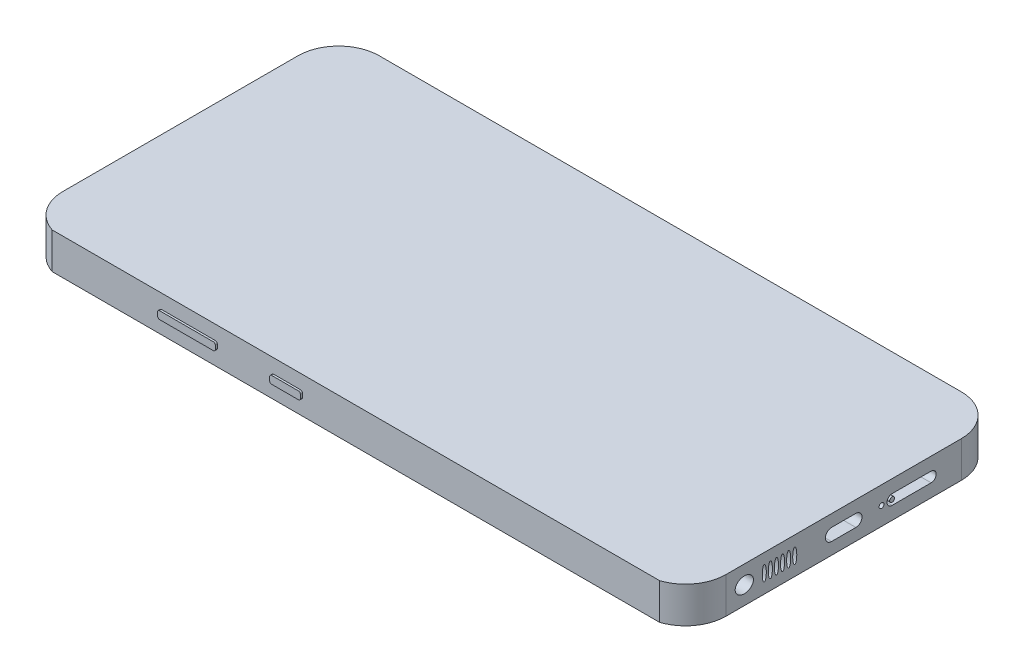
from build123d import *

# Parameters (mm, degrees)
EXTRUDE_1_DEPTH     = 8.9
CUT_EXTRUDE_START   = 163.3
SKETCH_2_R          = 0.6
SKETCH_2_RX         = 2.25
SKETCH_2_RY         = 1.9
SKETCH_2_RX_2       = 1.9
SKETCH_2_RY_2       = 0.5
CUT_EXTRUDE_5_DEPTH = 8.9
SKETCH_7_OUTSIDE_W  = 201.53
SKETCH_7_OUTSIDE_H  = 47.13
CUT_EXTRUDE_6_DEPTH = 0.5
CUT_EXTRUDE_7_DEPTH = 0.5


with BuildPart() as part:
    # 草图1 → 凸台-拉伸1 (new body)
    with BuildSketch(Plane(origin=(0, 0, 0), x_dir=(1, 0, 0), z_dir=(0, 1, 0))):
        with BuildLine():
            Line((10, 0), (153.3, 0))
            ThreePointArc((153.3, 0), (160.371067812, 2.928932188), (163.3, 10))
            Line((163.3, 10), (163.3, 67.9))
            ThreePointArc((163.3, 67.9), (160.371067812, 74.971067812), (153.3, 77.9))
            Line((153.3, 77.9), (10, 77.9))
            ThreePointArc((10, 77.9), (2.928932188, 74.971067812), (0, 67.9))
            Line((0, 67.9), (0, 10))
            ThreePointArc((0, 10), (2.928932188, 2.928932188), (10, 0))
        make_face()
    extrude(amount=EXTRUDE_1_DEPTH)

    # 草图2 → 切除-拉伸5 (cut)
    # profile 1 of 10: a face of its own
    with BuildSketch(Plane(origin=(0, 0, 0), x_dir=(0, 0, -1), z_dir=(1, 0, 0)).offset(CUT_EXTRUDE_START)):
        with Locations(Location((48.272527564, 4.45, 0), (0, 0, 180))):
            Circle(SKETCH_2_R)
    # profile 2 of 10: a face of its own
    with BuildSketch(Plane(origin=(0, 0, 0), x_dir=(0, 0, -1), z_dir=(1, 0, 0)).offset(CUT_EXTRUDE_START)):
        with Locations(Location((14.485427664, 4.45), (0, 0, 180))):
            Ellipse(SKETCH_2_RX, SKETCH_2_RY)
    # profile 3 of 10: a face of its own
    with BuildSketch(Plane(origin=(0, 0, 0), x_dir=(0, 0, -1), z_dir=(1, 0, 0)).offset(CUT_EXTRUDE_START)):
        with Locations(Location((19.399284115, 4.45), (0, 0, 90))):
            Ellipse(SKETCH_2_RX_2, SKETCH_2_RY_2)
    # profile 4 of 10: a face of its own
    with BuildSketch(Plane(origin=(0, 0, 0), x_dir=(0, 0, -1), z_dir=(1, 0, 0)).offset(CUT_EXTRUDE_START)):
        with Locations(Location((20.899284115, 4.45), (0, 0, 90))):
            Ellipse(SKETCH_2_RX_2, SKETCH_2_RY_2)
    # profile 5 of 10: a face of its own
    with BuildSketch(Plane(origin=(0, 0, 0), x_dir=(0, 0, -1), z_dir=(1, 0, 0)).offset(CUT_EXTRUDE_START)):
        with Locations(Location((22.399284115, 4.45), (0, 0, 90))):
            Ellipse(SKETCH_2_RX_2, SKETCH_2_RY_2)
    # profile 6 of 10: a face of its own
    with BuildSketch(Plane(origin=(0, 0, 0), x_dir=(0, 0, -1), z_dir=(1, 0, 0)).offset(CUT_EXTRUDE_START)):
        with Locations(Location((23.899284115, 4.45), (0, 0, 90))):
            Ellipse(SKETCH_2_RX_2, SKETCH_2_RY_2)
    # profile 7 of 10: a face of its own
    with BuildSketch(Plane(origin=(0, 0, 0), x_dir=(0, 0, -1), z_dir=(1, 0, 0)).offset(CUT_EXTRUDE_START)):
        with Locations(Location((25.399284115, 4.45), (0, 0, 90))):
            Ellipse(SKETCH_2_RX_2, SKETCH_2_RY_2)
    # profile 8 of 10: a face of its own
    with BuildSketch(Plane(origin=(0, 0, 0), x_dir=(0, 0, -1), z_dir=(1, 0, 0)).offset(CUT_EXTRUDE_START)):
        with Locations(Location((26.899284115, 4.45), (0, 0, 90))):
            Ellipse(SKETCH_2_RX_2, SKETCH_2_RY_2)
    # profile 9 of 10: a face of its own
    with BuildSketch(Plane(origin=(0, 0, 0), x_dir=(0, 0, -1), z_dir=(1, 0, 0)).offset(CUT_EXTRUDE_START)):
        with BuildLine():
            Line((41.95, 2.95), (35.95, 2.95))
            ThreePointArc((35.95, 2.95), (34.45, 4.45), (35.95, 5.95))
            Line((35.95, 5.95), (41.95, 5.95))
            ThreePointArc((41.95, 5.95), (43.45, 4.45), (41.95, 2.95))
        make_face()
    # profile 10 of 10: a face of its own
    with BuildSketch(Plane(origin=(0, 0, 0), x_dir=(0, 0, -1), z_dir=(1, 0, 0)).offset(CUT_EXTRUDE_START)):
        with BuildLine():
            Line((60.478464751, 3.2), (50.871535249, 3.2))
            ThreePointArc((50.871535249, 3.2), (49.621535249, 4.45), (50.871535249, 5.7))
            Line((50.871535249, 5.7), (60.478464751, 5.7))
            ThreePointArc((60.478464751, 5.7), (61.728464751, 4.45), (60.478464751, 3.2))
        make_face()
        with Locations(Location((50.871535249, 4.45, 0), (0, 0, 180))):
            Circle(SKETCH_2_R, mode=Mode.SUBTRACT)
    extrude(amount=-CUT_EXTRUDE_5_DEPTH, mode=Mode.SUBTRACT)

    # 草图7 outside → 切除-拉伸6 (cut)
    with BuildSketch(Plane.XY):
        with Locations((81.65, 4.45)):
            Rectangle(SKETCH_7_OUTSIDE_W, SKETCH_7_OUTSIDE_H)
        with BuildLine():
            Line((33.826473294, 3.502985919), (47.039275266, 3.502985919))
            ThreePointArc((47.039275266, 3.502985919), (47.392828657, 3.649432529), (47.539275266, 4.002985919))
            Line((47.539275266, 4.002985919), (47.539275266, 4.897014081))
            ThreePointArc((47.539275266, 4.897014081), (47.392828657, 5.250567471), (47.039275266, 5.397014081))
            Line((47.039275266, 5.397014081), (33.826473294, 5.397014081))
            ThreePointArc((33.826473294, 5.397014081), (33.472919903, 5.250567471), (33.326473294, 4.897014081))
            Line((33.326473294, 4.897014081), (33.326473294, 4.002985919))
            ThreePointArc((33.326473294, 4.002985919), (33.472919903, 3.649432529), (33.826473294, 3.502985919))
        make_face(mode=Mode.SUBTRACT)
        with BuildLine():
            Line((61.422997124, 3.502985919), (68.003158176, 3.502985919))
            ThreePointArc((68.003158176, 3.502985919), (68.356711566, 3.649432529), (68.503158176, 4.002985919))
            Line((68.503158176, 4.002985919), (68.503158176, 4.897014081))
            ThreePointArc((68.503158176, 4.897014081), (68.356711566, 5.250567471), (68.003158176, 5.397014081))
            Line((68.003158176, 5.397014081), (61.422997124, 5.397014081))
            ThreePointArc((61.422997124, 5.397014081), (61.069443733, 5.250567471), (60.922997124, 4.897014081))
            Line((60.922997124, 4.897014081), (60.922997124, 4.002985919))
            ThreePointArc((60.922997124, 4.002985919), (61.069443733, 3.649432529), (61.422997124, 3.502985919))
        make_face(mode=Mode.SUBTRACT)
    extrude(amount=-CUT_EXTRUDE_6_DEPTH, mode=Mode.SUBTRACT)

    # 草图8 → 切除-拉伸7 (cut)
    with BuildSketch(Plane.XZ):
        with BuildLine():
            Line((1.465261874, -67.9), (1.465261874, -10))
            ThreePointArc((1.465261874, -10), (3.965028796, -3.965028796), (10, -1.465261874))
            Line((10, -1.465261874), (153.3, -1.465261874))
            ThreePointArc((153.3, -1.465261874), (159.334971204, -3.965028796), (161.834738126, -10))
            Line((161.834738126, -10), (161.834738126, -67.9))
            ThreePointArc((161.834738126, -67.9), (159.334971204, -73.934971204), (153.3, -76.434738126))
            Line((153.3, -76.434738126), (10, -76.434738126))
            ThreePointArc((10, -76.434738126), (3.965028796, -73.934971204), (1.465261874, -67.9))
        make_face()
    extrude(amount=-CUT_EXTRUDE_7_DEPTH, mode=Mode.SUBTRACT)


solid = part.part
